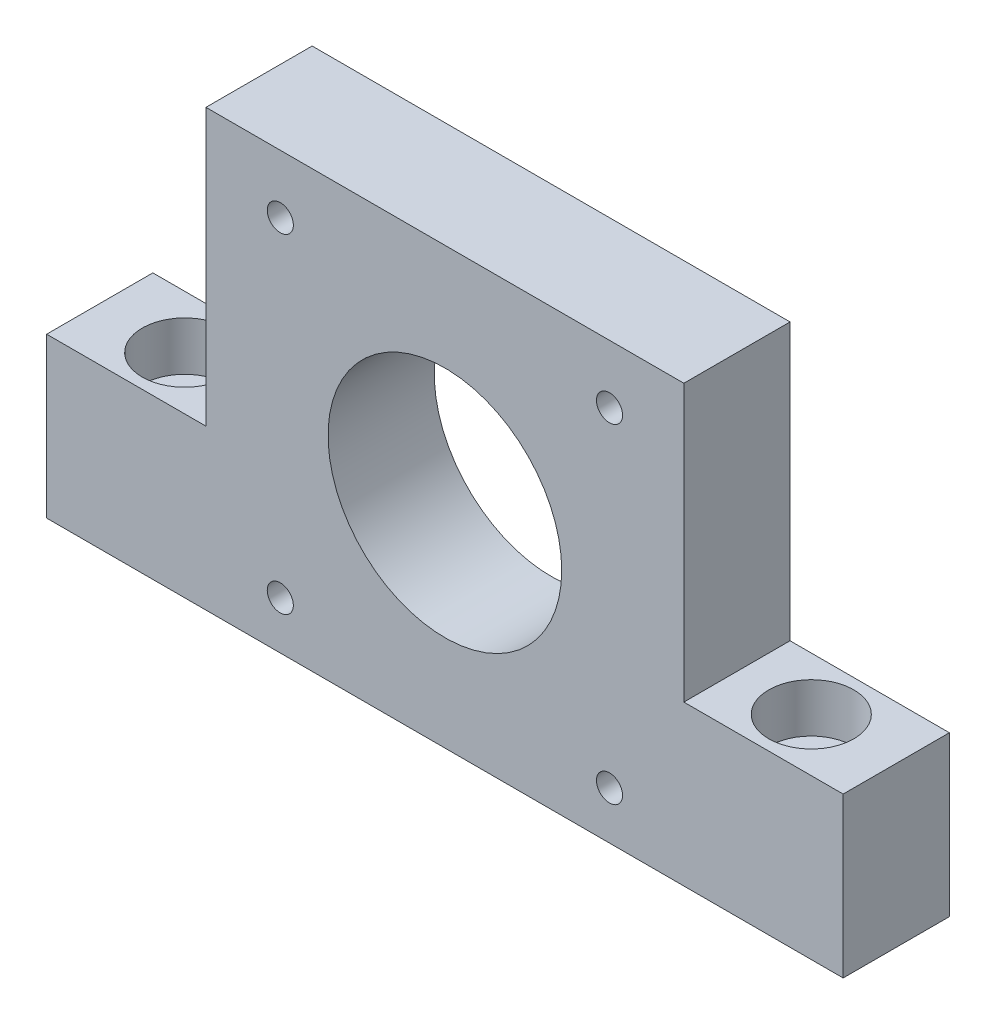
from build123d import *

# Parameters (mm, degrees)
EXTRUDE_1_DEPTH              = 10
SKETCH_2_R                   = 11
CUT_EXTRUDE_1_DEPTH          = 87.058119896
HOLE_WIZARD_M4_1_D           = 4.5
HOLE_WIZARD_M4_1_CBORE_D     = 8
HOLE_WIZARD_M4_1_CBORE_DEPTH = 4.6
SKETCH_3_R                   = 1.2295
CUT_EXTRUDE_2_DEPTH          = 87.058119896


with BuildPart() as part:
    # 草图1 → 凸台-拉伸1 (new body)
    with BuildSketch(Plane.XY):
        Polygon((0, 0), (75, 0), (75, 15), (60, 15), (60, 41), (15, 41), (15, 15), (0, 15), align=None)
    extrude(amount=EXTRUDE_1_DEPTH)

    # 草图2 → 切除-拉伸1 (cut, through all)
    with BuildSketch(Plane.XY.offset(10)):
        with Locations((37.5, 20)):
            Circle(SKETCH_2_R)
    extrude(amount=-CUT_EXTRUDE_1_DEPTH, mode=Mode.SUBTRACT)

    # M4 六角圆柱头螺钉的柱形沉头孔1 (through all)
    with Locations(Plane(origin=(8, 15, 5), x_dir=(1, 0, 0), z_dir=(0, 1, 0))):
        with Locations((0, 0), (59, 0)):
            CounterBoreHole(HOLE_WIZARD_M4_1_D / 2, HOLE_WIZARD_M4_1_CBORE_D / 2, HOLE_WIZARD_M4_1_CBORE_DEPTH)

    # 草图3 → 切除-拉伸2 (cut, through all)
    with BuildSketch(Plane(origin=(0, 0, 0), x_dir=(-1, 0, 0), z_dir=(0, 0, -1))):
        with Locations((-22, 4.5)):
            Circle(SKETCH_3_R)
        with Locations(Location((-53, 4.5, 0), (0, 0, 180))):
            Circle(SKETCH_3_R)
        with Locations((-53, 35.5)):
            Circle(SKETCH_3_R)
        with Locations(Location((-22, 35.5, 0), (0, 0, 180))):
            Circle(SKETCH_3_R)
    extrude(amount=-CUT_EXTRUDE_2_DEPTH, mode=Mode.SUBTRACT)


solid = part.part
